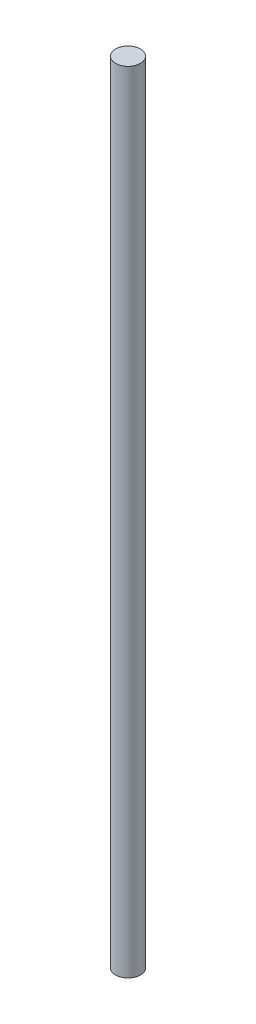
from build123d import *

# Parameters (mm, degrees)
OVEN_KESME_KILAVUZ_MILI_D12_1_START = 400
SKETCH1_R                           = 6
OVEN_KESME_KILAVUZ_MILI_D12_1_DEPTH = 380


with BuildPart() as part:
    # Sketch1 → OVEN_kesme_kilavuz_mili_D12_1 (new body)
    with BuildSketch(Plane(origin=(0, 0, 0), x_dir=(1, 0, 0), z_dir=(0, 1, 0)).offset(OVEN_KESME_KILAVUZ_MILI_D12_1_START)):
        with Locations(Location((150, 300, 0), (0, 0, 270))):
            Circle(SKETCH1_R)
    extrude(amount=OVEN_KESME_KILAVUZ_MILI_D12_1_DEPTH)


solid = part.part
